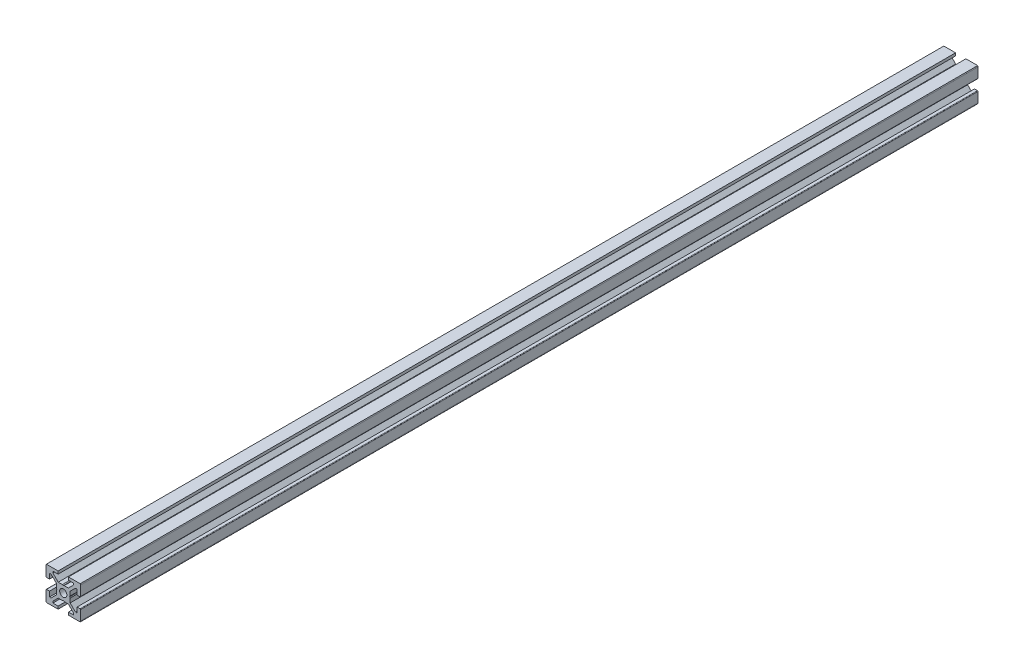
from build123d import *

# Parameters (mm, degrees)
SKETCH_3_R      = 2.0999999
EXTRUDE_1_DEPTH = 520


with BuildPart() as part:
    # 草图3 → 凸台-拉伸1 (new body)
    with BuildSketch(Plane.XY):
        with BuildLine():
            Line((57.060659494, 56.000000011), (54.000002413, 52.939342929))
            Line((54.000002413, 52.939342929), (54.000002413, 50.519633796))
            Line((54.000002413, 50.519633796), (53.700020897, 50.000006546))
            Line((53.700020897, 50.000006546), (54.000002413, 49.480359881))
            Line((54.000002413, 49.480359881), (54.000002413, 47.060657071))
            Line((54.000002413, 47.060657071), (57.060659494, 43.999999989))
            Line((57.060659494, 43.999999989), (57.999999993, 43.999999989))
            Line((57.999999993, 43.999999989), (57.999999993, 46.999999994))
            Line((57.999999993, 46.999999994), (59.699999997, 46.999999994))
            ThreePointArc((59.699999997, 46.999999994), (59.912132029, 46.912132029), (59.999999993, 46.699999998))
            Line((59.999999993, 46.699999998), (59.999999993, 41))
            ThreePointArc((59.999999993, 41), (59.948683291, 40.683772234), (59.799999994, 40.400000001))
            Line((59.799999994, 40.400000001), (52.999999994, 40.400000001))
            Line((52.999999994, 40.400000001), (52.999999994, 42))
            Line((52.999999994, 42), (55.999999999, 42))
            Line((55.999999999, 42), (55.999999999, 42.939340499))
            Line((55.999999999, 42.939340499), (52.939327623, 45.999997582))
            Line((52.939327623, 45.999997582), (50.519608524, 45.999997582))
            Line((50.519608524, 45.999997582), (49.99999391, 46.300000984))
            Line((49.99999391, 46.300000984), (49.48035988, 45.999997582))
            Line((49.48035988, 45.999997582), (47.06065707, 45.999997582))
            Line((47.06065707, 45.999997582), (43.99999999, 42.939340499))
            Line((43.99999999, 42.939340499), (43.99999999, 42))
            Line((43.99999999, 42), (46.999999994, 42))
            Line((46.999999994, 42), (46.999999994, 40.400000001))
            Line((46.999999994, 40.400000001), (40.199999995, 40.400000001))
            ThreePointArc((40.199999995, 40.400000001), (40.051316697, 40.683772234), (39.999999996, 41))
            Line((39.999999996, 41), (39.999999996, 46.699999998))
            ThreePointArc((39.999999996, 46.699999998), (40.08786796, 46.912132029), (40.299999991, 46.999999994))
            Line((40.299999991, 46.999999994), (41.999999996, 46.999999994))
            Line((41.999999996, 46.999999994), (41.999999996, 43.999999989))
            Line((41.999999996, 43.999999989), (42.939340495, 43.999999989))
            Line((42.939340495, 43.999999989), (45.999997575, 47.060657071))
            Line((45.999997575, 47.060657071), (45.999997575, 49.480366204))
            Line((45.999997575, 49.480366204), (46.300000986, 49.999980814))
            Line((46.300000986, 49.999980814), (45.999997575, 50.519614839))
            Line((45.999997575, 50.519614839), (45.999997575, 52.939323971))
            Line((45.999997575, 52.939323971), (42.939315735, 56.000000011))
            Line((42.939315735, 56.000000011), (41.999999996, 56.000000011))
            Line((41.999999996, 56.000000011), (41.999999996, 53.000000007))
            Line((41.999999996, 53.000000007), (40.299999991, 53.000000007))
            ThreePointArc((40.299999991, 53.000000007), (40.08786796, 53.087867971), (39.999999996, 53.300000003))
            Line((39.999999996, 53.300000003), (39.999999996, 59))
            ThreePointArc((39.999999996, 59), (40.051316697, 59.316227766), (40.199999995, 59.6))
            Line((40.199999995, 59.6), (46.999999994, 59.6))
            Line((46.999999994, 59.6), (46.999999994, 58))
            Line((46.999999994, 58), (43.99999999, 58))
            Line((43.99999999, 58), (43.99999999, 57.060659501))
            Line((43.99999999, 57.060659501), (47.060664718, 53.999994771))
            Line((47.060664718, 53.999994771), (49.480367527, 53.999994771))
            Line((49.480367527, 53.999994771), (49.999987125, 53.7))
            Line((49.999987125, 53.7), (50.519626138, 53.999994771))
            Line((50.519626138, 53.999994771), (52.939335271, 53.999994771))
            Line((52.939335271, 53.999994771), (55.999999999, 57.060659501))
            Line((55.999999999, 57.060659501), (55.999999999, 58))
            Line((55.999999999, 58), (52.999999994, 58))
            Line((52.999999994, 58), (52.999999994, 59.6))
            Line((52.999999994, 59.6), (59.799999994, 59.6))
            ThreePointArc((59.799999994, 59.6), (59.948683291, 59.316227766), (59.999999993, 59))
            Line((59.999999993, 59), (59.999999993, 53.300000003))
            ThreePointArc((59.999999993, 53.300000003), (59.912132029, 53.087867971), (59.699999997, 53.000000007))
            Line((59.699999997, 53.000000007), (57.999999993, 53.000000007))
            Line((57.999999993, 53.000000007), (57.999999993, 56.000000011))
            Line((57.999999993, 56.000000011), (57.060659494, 56.000000011))
        make_face()
        with Locations((50, 50)):
            Circle(SKETCH_3_R, mode=Mode.SUBTRACT)
    extrude(amount=EXTRUDE_1_DEPTH)


solid = part.part
